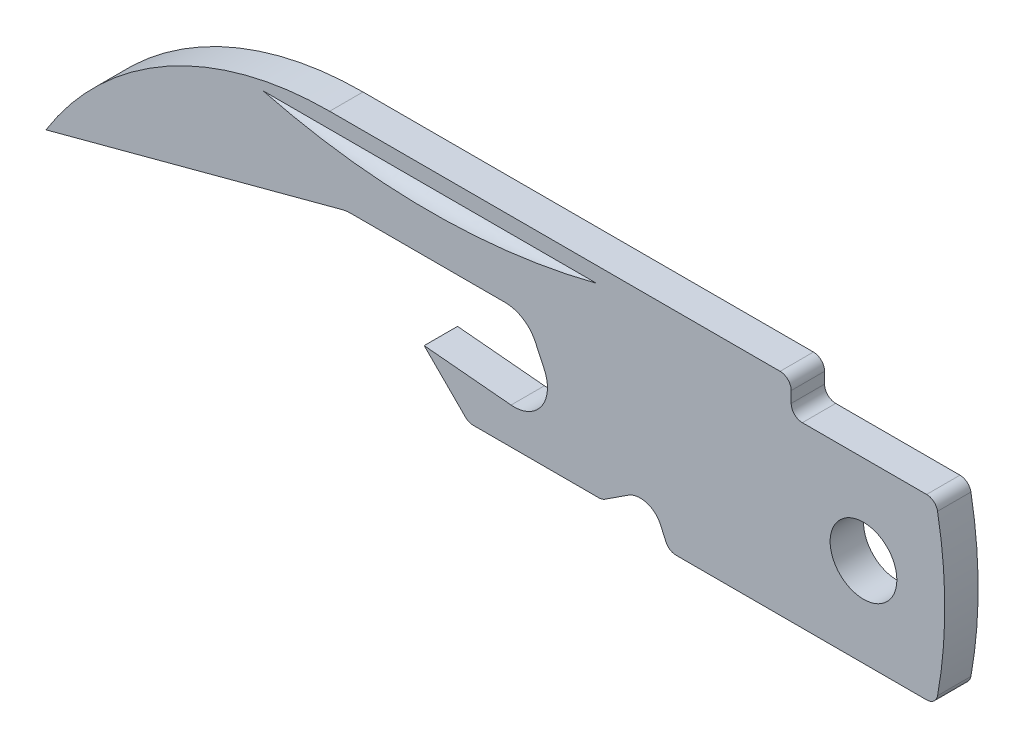
from build123d import *

# Parameters (mm, degrees)
SKETCH1_R           = 1.5
BOSS_EXTRUDE1_DEPTH = 0.75
BOSS_EXTRUDE2_DEPTH = 0.75
FILLET1_R           = 1
FILLET2_R           = 0.5
FILLET3_R           = 1.5
CUT_REVOLVE1_ANGLE  = 90


with BuildPart() as part:
    # Sketch1 → Boss-Extrude1 (new, symmetric)
    with BuildSketch(Plane.XY):
        with BuildLine():
            Line((-13, 5.5), (-3.25, 5.5))
            Line((-3.25, 5.5), (-3.25, 4))
            Line((-3.25, 4), (3.25, 4))
            ThreePointArc((3.25, 4), (3.654082058, 0), (3.25, -4))
            Line((3.25, -4), (-8.75, -4))
            Line((-8.75, -4), (-13, 5.5))
        make_face()
        Circle(SKETCH1_R, mode=Mode.SUBTRACT)
    extrude(amount=BOSS_EXTRUDE1_DEPTH, both=True)

    # Sketch7 → Boss-Extrude2 (add, symmetric)
    with BuildSketch(Plane.XY):
        with BuildLine():
            Line((-13, 5.5), (-24, 5.5))
            ThreePointArc((-24, 5.5), (-31.29725976, 3.605342422), (-36.751078386, -1.6))
            Line((-36.751078386, -1.6), (-23.25, 2))
            Line((-23.25, 2), (-15.15, 2))
            Line((-15.15, 2), (-13.25, -2.1))
            Line((-13.25, -2.1), (-19.75, -1.5))
            Line((-19.75, -1.5), (-17.75, -3.5))
            Line((-17.75, -3.5), (-11.75, -3.5))
            Line((-11.75, -3.5), (-9.6, -2.1))
            Line((-9.6, -2.1), (-13, 5.5))
        make_face()
    extrude(amount=BOSS_EXTRUDE2_DEPTH, both=True)

    # Fillet1
    fillet1_edges = [part.edges().sort_by_distance(p)[0] for p in [
        (-9.6, -2.1, 0),
    ]]
    fillet(fillet1_edges, radius=FILLET1_R)

    # Fillet2
    fillet2_edges = [part.edges().sort_by_distance(p)[0] for p in [
        (-3.25, 4, 0),
        (3.25, 4, 0),
        (3.25, -4, 0),
        (-8.75, -4, 0),
        (-3.25, 5.5, 0),
        (-17.75, -3.5, 0),
        (-11.75, -3.5, 0),
    ]]
    fillet(fillet2_edges, radius=FILLET2_R)

    # Fillet3
    fillet3_edges = [part.edges().sort_by_distance(p)[0] for p in [
        (-23.25, 2, 0),
        (-15.15, 2, 0),
        (-13.25, -2.1, 0),
    ]]
    fillet(fillet3_edges, radius=FILLET3_R)

    # Sketch6 → Cut-Revolve1 (revolve, cut)
    with BuildSketch(Plane.XY.offset(0.75)):
        with BuildLine():
            Line((-27, 4.8), (-12, 4.8))
            ThreePointArc((-12, 4.8), (-19.5, 3.847375097), (-27, 4.8))
        make_face()
    revolve(axis=Axis((-27, 4.8, 0.75), (1, 0, 0)), revolution_arc=CUT_REVOLVE1_ANGLE, mode=Mode.SUBTRACT)


solid = part.part
